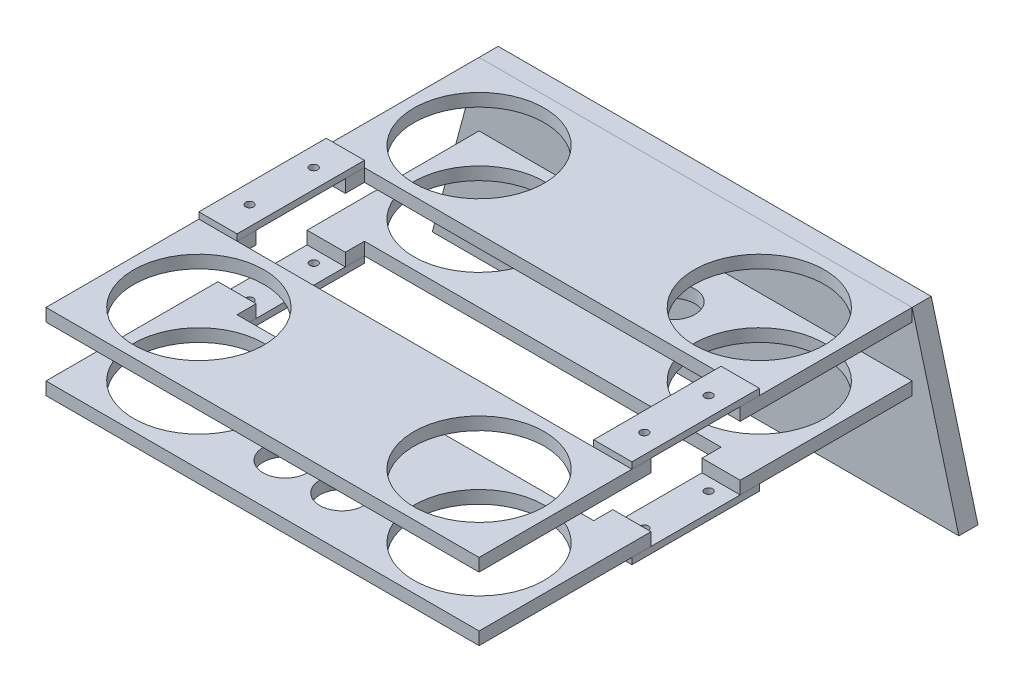
from build123d import *

# Parameters (mm, degrees)
SKETCH3_W           = 107.95
SKETCH3_H           = 76.2
SKETCH3_R           = 32.5
BOSS_EXTRUDE1_DEPTH = 6.35
SKETCH12_W          = 19.05
SKETCH12_H          = 9.525
BOSS_EXTRUDE8_DEPTH = 6.35
SKETCH5_R           = 10.9728
CUT_EXTRUDE1_DEPTH  = 156.930970304
CIRPATTERN2_COUNT   = 2
BOSS_EXTRUDE5_DEPTH = 9.525
SKETCH13_W          = 19.05
SKETCH13_H          = 63.5
BOSS_EXTRUDE9_DEPTH = 3.175
SKETCH14_R          = 2
CUT_EXTRUDE2_DEPTH  = 3.175


with BuildPart() as part:
    # Sketch3 → Boss-Extrude1 (new body)
    with BuildSketch(Plane(origin=(0, 53.975, 0), x_dir=(1, 0, 0), z_dir=(0, 1, 0))):
        with Locations((-53.975, 69.85)):
            Rectangle(SKETCH3_W, SKETCH3_H)
        with Locations(Location((-69.85, 69.85, 0), (0, 0, 270))):
            Circle(SKETCH3_R, mode=Mode.SUBTRACT)
    extrude(amount=BOSS_EXTRUDE1_DEPTH)

    # Sketch12 → Boss-Extrude8 (add)
    with BuildSketch(Plane(origin=(0, 60.325, 0), x_dir=(1, 0, 0), z_dir=(0, 1, 0))):
        with Locations((-98.425, 26.9875)):
            Rectangle(SKETCH12_W, SKETCH12_H)
    extrude(amount=-BOSS_EXTRUDE8_DEPTH)


with BuildPart() as body_2:
    # Mirror1: mirrored copy
    add(part.part.mirror(Plane.ZX.offset(73.025)))

    # Mirror2 2: body 2 across plane


with BuildPart() as part_1:
    add(part.part)

    # Mirror2: part across plane
    add(part.part.mirror(Plane(origin=(0, 0, 0), x_dir=(0, 0, 1), z_dir=(1, 0, 0))))

    # Sketch5 → Cut-Extrude1 (cut, through all)
    with BuildSketch(Plane(origin=(0, 60.325, 0), x_dir=(1, 0, 0), z_dir=(0, 1, 0))):
        with Locations(Location((-14.12897614, 82.55, 0), (0, 0, 270))):
            Circle(SKETCH5_R)
    cut_extrude1 = extrude(amount=-CUT_EXTRUDE1_DEPTH, mode=Mode.SUBTRACT)

    # Mirror8: Cut-Extrude1 across plane
    add(cut_extrude1.mirror(Plane(origin=(0, 0, 0), x_dir=(0, 0, 1), z_dir=(1, 0, 0))), mode=Mode.SUBTRACT)


with BuildPart() as body_2_1:
    add(body_2.part)
    add(body_2.part.mirror(Plane(origin=(0, 0, 0), x_dir=(0, 0, 1), z_dir=(1, 0, 0))))


with BuildPart() as cirpattern2_1:
    # CirPattern2: pattern copy
    add(part_1.part.rotate(Axis((0, 0, 0), (0, 1, 0)), 1 * 360 / CIRPATTERN2_COUNT))


with BuildPart() as cirpattern2_2:
    # CirPattern2: pattern copy
    add(body_2_1.part.rotate(Axis((0, 0, 0), (0, 1, 0)), 1 * 360 / CIRPATTERN2_COUNT))


with BuildPart() as body_5:
    # Sketch9 → Boss-Extrude5 (new body)
    with BuildSketch(Plane(origin=(0, 0, -107.95), x_dir=(-1, 0, 0), z_dir=(0, 0, -1))):
        Polygon((-107.95, 92.075), (-131.260239996, 5.08), (131.260239996, 5.08), (107.95, 92.075), align=None)
    extrude(amount=BOSS_EXTRUDE5_DEPTH)


with BuildPart() as body_6:
    # Sketch13 → Boss-Extrude9 (new body)
    with BuildSketch(Plane(origin=(0, 92.075, 0), x_dir=(1, 0, 0), z_dir=(0, 1, 0))):
        with Locations((-98.425, 0)):
            Rectangle(SKETCH13_W, SKETCH13_H)
    extrude(amount=BOSS_EXTRUDE9_DEPTH)

    # Sketch14 → Cut-Extrude2 (cut)
    with BuildSketch(Plane(origin=(0, 95.25, 0), x_dir=(1, 0, 0), z_dir=(0, 1, 0))):
        with Locations(Location((-98.425, 16, 0), (0, 0, 270))):
            Circle(SKETCH14_R)
        with Locations(Location((-98.425, -16, 0), (0, 0, 270))):
            Circle(SKETCH14_R)
    extrude(amount=-CUT_EXTRUDE2_DEPTH, mode=Mode.SUBTRACT)


with BuildPart() as body_7:
    # Mirror11: mirrored copy
    add(body_6.part.mirror(Plane.ZX.offset(73.025)))


with BuildPart() as body_8:
    # Mirror12: mirrored copy
    add(body_6.part.mirror(Plane(origin=(0, 0, 0), x_dir=(0, 0, 1), z_dir=(1, 0, 0))))


with BuildPart() as body_9:
    # Mirror12 2: mirrored copy
    add(body_7.part.mirror(Plane(origin=(0, 0, 0), x_dir=(0, 0, 1), z_dir=(1, 0, 0))))


solid = Compound([part_1.part, body_2_1.part, cirpattern2_1.part, cirpattern2_2.part, body_5.part, body_6.part, body_7.part, body_8.part, body_9.part])
